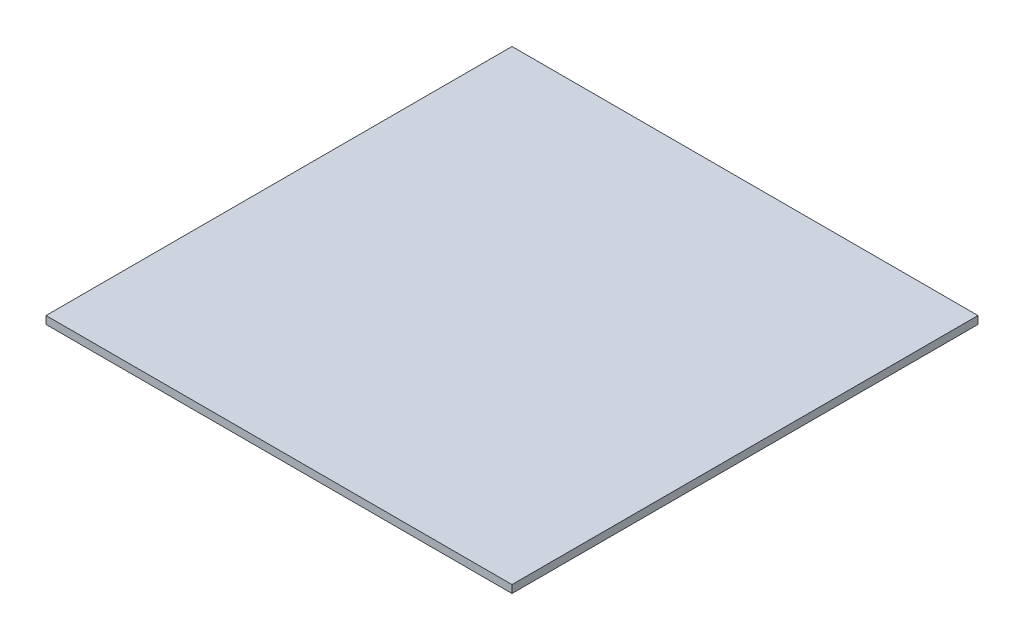
from build123d import *

# Parameters (mm, degrees)
SKETCH1_W           = 304.8
SKETCH1_H           = 304.8
BOSS_EXTRUDE1_DEPTH = 5.08


with BuildPart() as part:
    # Sketch1 → Boss-Extrude1 (new body)
    with BuildSketch(Plane(origin=(0, 0, 0), x_dir=(1, 0, 0), z_dir=(0, 1, 0))):
        Rectangle(SKETCH1_W, SKETCH1_H)
    extrude(amount=BOSS_EXTRUDE1_DEPTH)


solid = part.part
